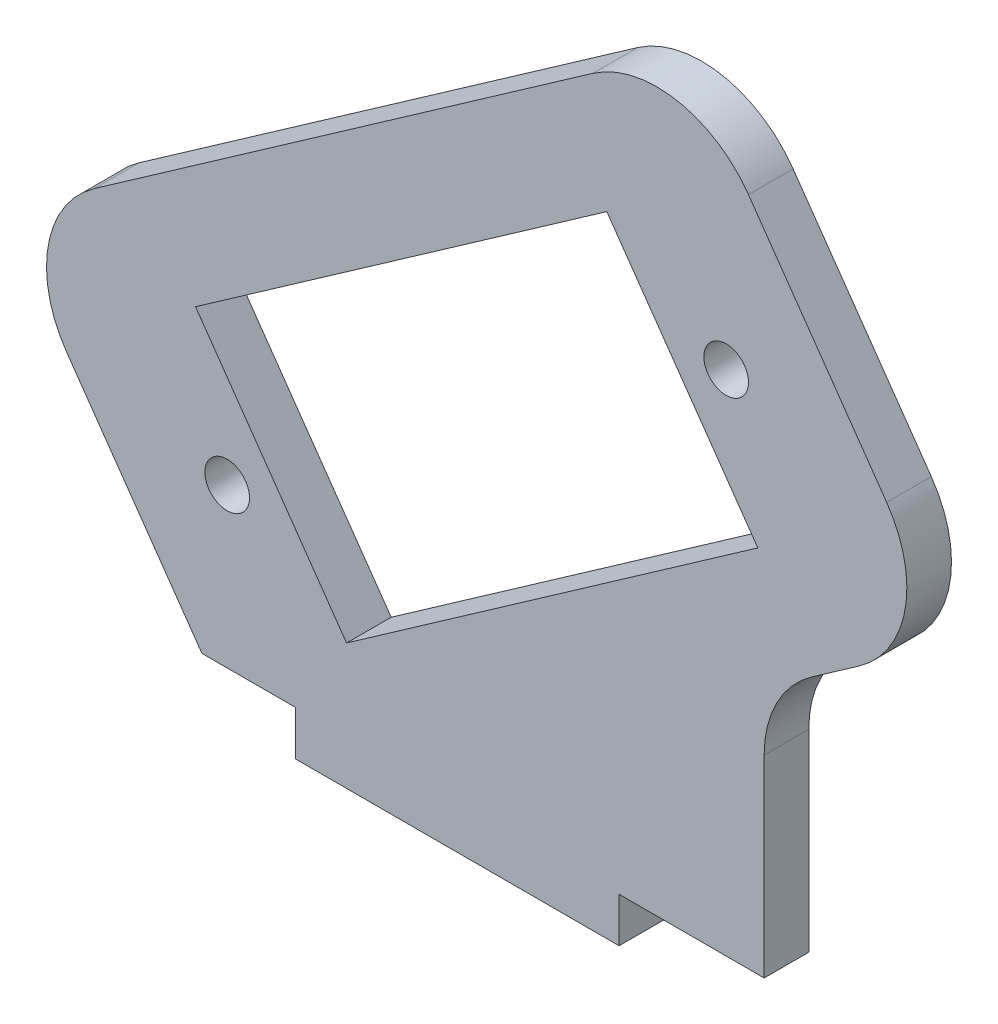
from build123d import *

# Parameters (mm, degrees)
SKETCH1_R           = 1
BOSS_EXTRUDE1_DEPTH = 2


with BuildPart() as part:
    # Sketch1 → Boss-Extrude1 (new body)
    with BuildSketch(Plane.XY):
        with BuildLine():
            Line((0, 0), (14.5, 0))
            Line((14.5, 0), (14.5, 2))
            Line((14.5, 2), (21, 2))
            Line((21, 2), (21, 10.652873099))
            ThreePointArc((21, 10.652873099), (21.564945834, 12.961616165), (23.132117818, 14.74863332))
            Line((23.132117818, 14.74863332), (25.264156906, 16.241503161))
            ThreePointArc((25.264156906, 16.241503161), (27.320313489, 19.469022494), (26.492034945, 23.205145564))
            Line((26.492034945, 23.205145564), (20.297409433, 32.051987643))
            ThreePointArc((20.297409433, 32.051987643), (17.0698901, 34.108144226), (13.33376703, 33.279865682))
            Line((13.33376703, 33.279865682), (-9.02908378, 17.62122897))
            ThreePointArc((-9.02908378, 17.62122897), (-11.085240363, 14.393709637), (-10.256961819, 10.657586567))
            Line((-10.256961819, 10.657586567), (-4.194854443, 2))
            Line((-4.194854443, 2), (0, 2))
            Line((0, 2), (0, 0))
        make_face()
        with Locations((-3.063888841, 9.102047709)):
            Circle(SKETCH1_R, mode=Mode.SUBTRACT)
        with Locations((19.298961968, 24.760684422)):
            Circle(SKETCH1_R, mode=Mode.SUBTRACT)
        Polygon((-4.48202491, 15.311628218), (13.948896087, 28.217098036), (20.717098036, 18.551103913), (2.286177039, 5.645634095), align=None, mode=Mode.SUBTRACT)
    extrude(amount=BOSS_EXTRUDE1_DEPTH)


solid = part.part
